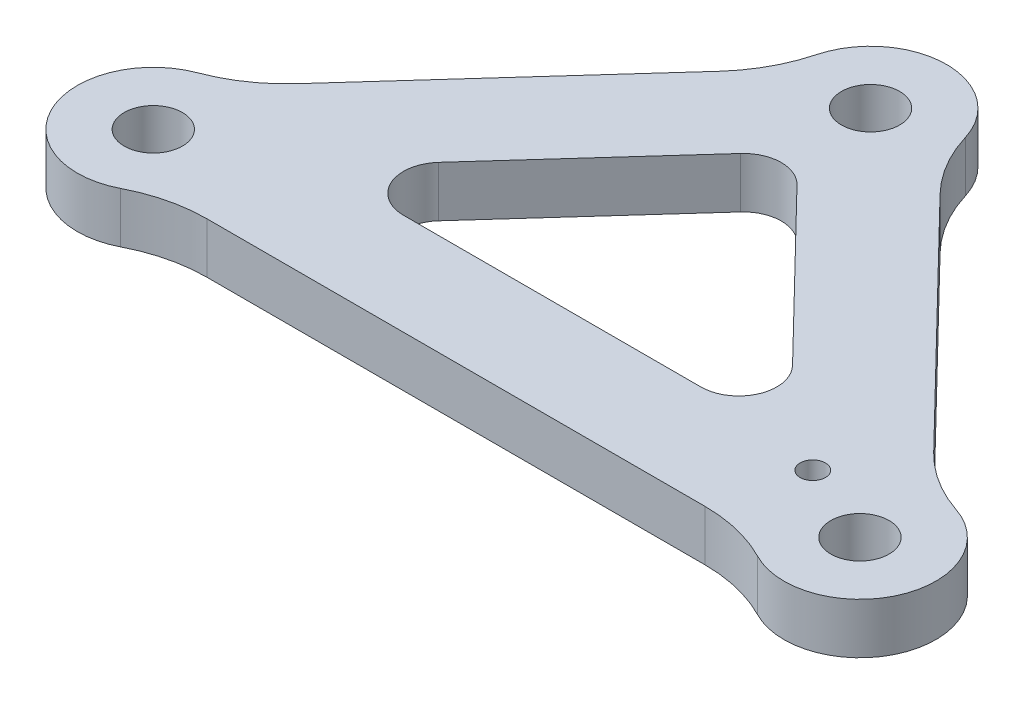
from build123d import *

# Parameters (mm, degrees)
SKETCH_1_R      = 1.15
SKETCH_1_R_2    = 0.5
EXTRUDE_1_DEPTH = 2
FILLET_1_R      = 6
FILLET_2_R      = 1.5


with BuildPart() as part:
    # Эскиз1 → Бобышка-Вытянуть1 (new body)
    with BuildSketch(Plane(origin=(0, 0, 0), x_dir=(1, 0, 0), z_dir=(0, 1, 0))):
        with BuildLine():
            Line((25.663932023, -2), (2.236067977, -2))
            ThreePointArc((2.236067977, -2), (-2.74154128, -1.218175444), (0.014385141, 2.999965511))
            Line((0.014385141, 2.999965511), (10.455183999, 14.561088615))
            ThreePointArc((10.455183999, 14.561088615), (13.383244259, 17.879619162), (16.430840693, 14.670516819))
            Line((16.430840693, 14.670516819), (27.775788612, 2.997427486))
            ThreePointArc((27.775788612, 2.997427486), (30.663385612, -1.167775647), (25.663932023, -2))
        make_face()
        with Locations(Location((0, 0, 0), (0, 0, 270))):
            Circle(SKETCH_1_R, mode=Mode.SUBTRACT)
        with Locations(Location((27.9, 0, 0), (0, 0, 270))):
            Circle(SKETCH_1_R, mode=Mode.SUBTRACT)
        with Locations(Location((13.438172043, 14.880122047, 0), (0, 0, 270))):
            Circle(SKETCH_1_R, mode=Mode.SUBTRACT)
        with Locations(Location((24.67605012, 1.362404921, 0), (0, 0, 270))):
            Circle(SKETCH_1_R_2, mode=Mode.SUBTRACT)
        Polygon((13.491730689, 11.955390865), (4.501061475, 2), (23.167266244, 2), align=None, mode=Mode.SUBTRACT)
    extrude(amount=EXTRUDE_1_DEPTH)

    # Скругление1
    fillet_1_edges = [part.edges().sort_by_distance(p)[0] for p in [
        (10.455183999, 1, -14.561088615),
        (16.430840693, 1, -14.670516819),
        (27.775788612, 1, -2.997427486),
        (25.663932023, 1, 2),
        (2.236067977, 1, 2),
        (0.014385141, 1, -2.999965511),
    ]]
    fillet(fillet_1_edges, radius=FILLET_1_R)

    # Скругление2
    fillet_2_edges = [part.edges().sort_by_distance(p)[0] for p in [
        (4.501061475, 1, -2),
        (23.167266244, 1, -2),
        (13.491730689, 1, -11.955390865),
    ]]
    fillet(fillet_2_edges, radius=FILLET_2_R)


solid = part.part
